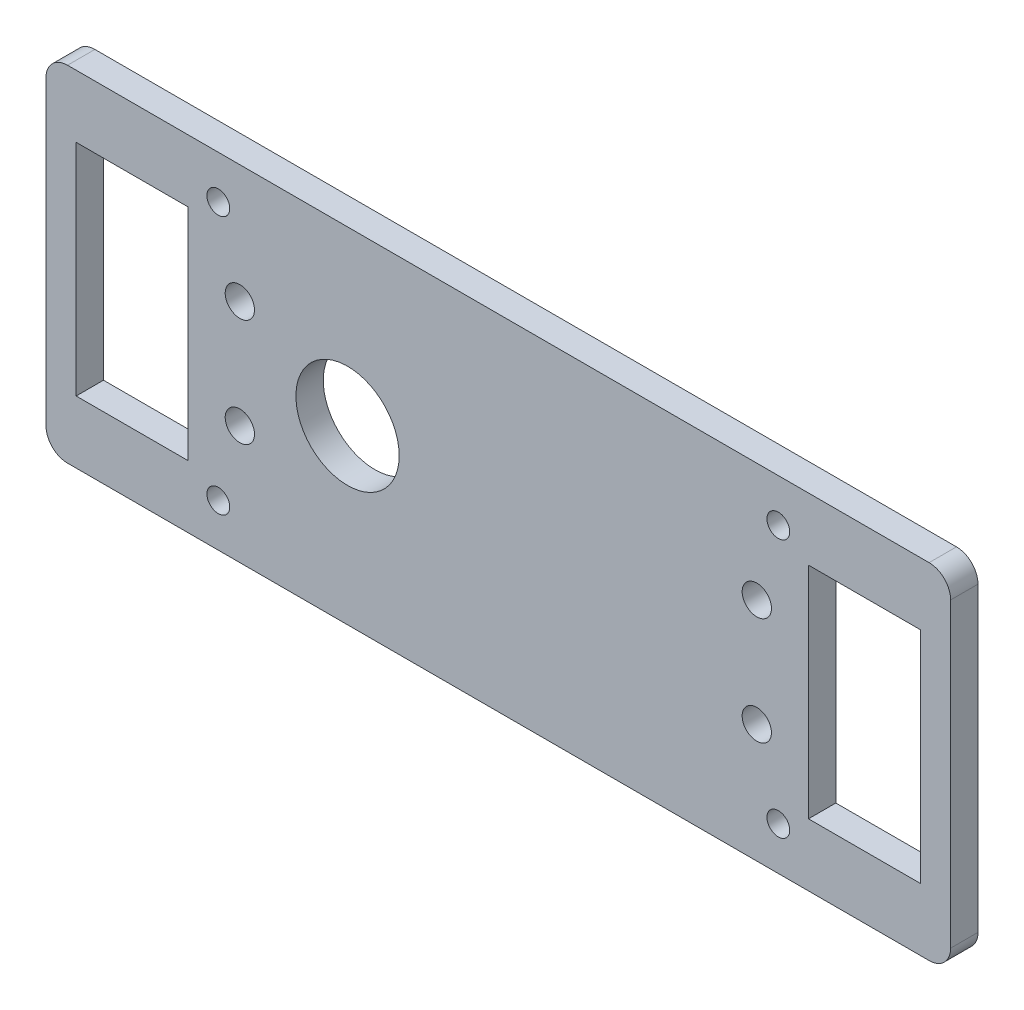
from build123d import *

# Parameters (mm, degrees)
SKETCH1_W                    = 210
SKETCH1_H                    = 80
SKETCH1_R                    = 11.9875
SKETCH1_W_2                  = 26
SKETCH1_H_2                  = 51
BOSS_EXTRUDE1_DEPTH          = 6.35
M5_CLEARANCE_HOLE1_D         = 5.3
FILLET1_R                    = 5
TAP_DRILL_FOR_M8X1_25_TAP1_D = 6.8


with BuildPart() as part:
    # Sketch1 → Boss-Extrude1 (new body)
    with BuildSketch(Plane.XY):
        with Locations((35, 0)):
            Rectangle(SKETCH1_W, SKETCH1_H)
        Circle(SKETCH1_R, mode=Mode.SUBTRACT)
        with Locations((-50, 0)):
            Rectangle(SKETCH1_W_2, SKETCH1_H_2, mode=Mode.SUBTRACT)
        with Locations((120, 0)):
            Rectangle(SKETCH1_W_2, SKETCH1_H_2, mode=Mode.SUBTRACT)
    extrude(amount=-BOSS_EXTRUDE1_DEPTH)

    # M5 Clearance Hole1 (through all)
    with Locations(Plane(origin=(-30, 30, 0), x_dir=(1, 0, 0), z_dir=(0, 0, 1))):
        with Locations((0, 0), (0, -60), (130, -60), (130, 0)):
            Hole(M5_CLEARANCE_HOLE1_D / 2)

    # Fillet1
    fillet1_edges = [part.edges().sort_by_distance(p)[0] for p in [
        (-70, 40, -3.175),
        (140, 40, -3.175),
        (140, -40, -3.175),
        (-70, -40, -3.175),
    ]]
    fillet(fillet1_edges, radius=FILLET1_R)

    # Tap Drill for M8x1.25 Tap1 (through all)
    with Locations(Plane(origin=(-25, 12.5, 0), x_dir=(1, 0, 0), z_dir=(0, 0, 1))):
        with Locations((0, 0), (0, -25), (120, 0), (120, -25)):
            Hole(TAP_DRILL_FOR_M8X1_25_TAP1_D / 2)


solid = part.part
